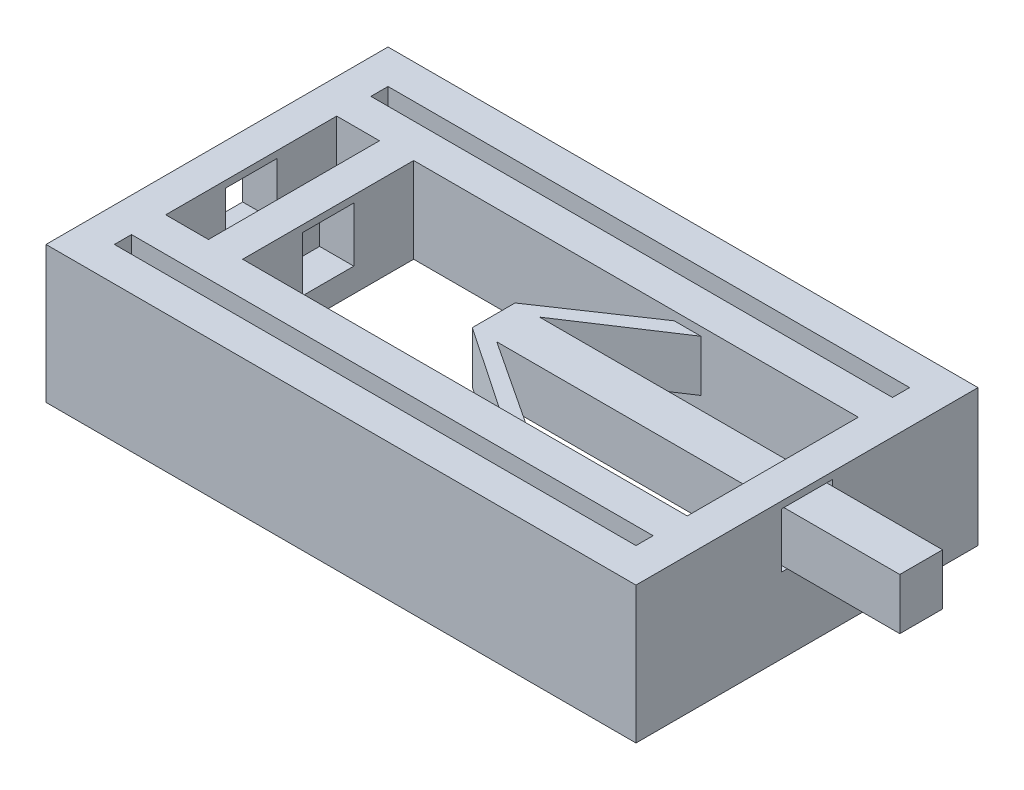
from build123d import *

# Parameters (mm, degrees)
BOSS_EXTRUDE2_DEPTH      = 3.5
BOSS_EXTRUDE2_DEPTH_BACK = 1.5
SKETCH2_W                = 34.5
SKETCH2_H                = 14
SKETCH2_W_2              = 2.5
SKETCH2_H_2              = 10
SKETCH2_W_3              = 26
BOSS_EXTRUDE5_DEPTH      = 3.5
BOSS_EXTRUDE5_DEPTH_BACK = 4.5
SKETCH9_W                = 30.5
SKETCH9_H                = 16
CUT_EXTRUDE1_DEPTH       = 2
CUT_EXTRUDE2_DEPTH       = 8
BOSS_EXTRUDE4_DEPTH      = 3
SKETCH5_W                = 7
SKETCH5_H                = 1
CUT_EXTRUDE3_DEPTH       = 1
CUT_EXTRUDE4_DEPTH       = 6
CUT_EXTRUDE4_DEPTH_BACK  = 6
SKETCH7_R                = 0.2


with BuildPart() as part:
    # Sketch2 → Boss-Extrude2 (new, two sides: drawn at the far end of the back side and taken through both)
    with BuildSketch(Plane(origin=(0, 0, 0), x_dir=(1, 0, 0), z_dir=(0, 1, 0)).offset(-BOSS_EXTRUDE2_DEPTH_BACK)):
        Rectangle(SKETCH2_W, SKETCH2_H)
        with Locations((-14, 0)):
            Rectangle(SKETCH2_W_2, SKETCH2_H_2, mode=Mode.SUBTRACT)
        with Locations((2.25, 0)):
            Rectangle(SKETCH2_W_3, SKETCH2_H_2, mode=Mode.SUBTRACT)
    extrude(amount=BOSS_EXTRUDE2_DEPTH + BOSS_EXTRUDE2_DEPTH_BACK)

    # Sketch9 → Boss-Extrude5 (add, two sides: drawn at the far end of the back side and taken through both)
    with BuildSketch(Plane(origin=(0, 0, 0), x_dir=(1, 0, 0), z_dir=(0, 1, 0)).offset(-BOSS_EXTRUDE5_DEPTH_BACK)):
        Polygon((17.25, -10), (17.25, 8), (17.25, 10), (15.25, 10), (-15.25, 10), (-17.25, 10), (-17.25, 8), (-17.25, -10), align=None)
        Rectangle(SKETCH9_W, SKETCH9_H, mode=Mode.SUBTRACT)
    extrude(amount=BOSS_EXTRUDE5_DEPTH + BOSS_EXTRUDE5_DEPTH_BACK)

    # Sketch3 → Cut-Extrude1 (cut)
    with BuildSketch(Plane(origin=(17.25, 0, 0), x_dir=(0, 0, -1), z_dir=(1, 0, 0))):
        Polygon((-1.5, 0), (-1.5, 3.1), (1.5, 3.1), (1.5, 0), (1.5, -0.1), (-1.5, -0.1), align=None)
    extrude(amount=-CUT_EXTRUDE1_DEPTH, mode=Mode.SUBTRACT)

    # Sketch4 → Cut-Extrude2 (cut)
    with BuildSketch(Plane.ZY.offset(17.25)):
        Polygon((-1.5, -0.1), (1.5, -0.1), (1.5, 0), (1.5, 3.1), (-1.5, 3.1), (-1.5, 0), align=None)
    extrude(amount=-CUT_EXTRUDE2_DEPTH, mode=Mode.SUBTRACT)

    # Sketch1 → Boss-Extrude4 (add)
    with BuildSketch(Plane(origin=(0, 0, 0), x_dir=(1, 0, 0), z_dir=(0, 1, 0))):
        Polygon((-1.07297499, -1.25), (4.486628642, -5), (4.486628642, -6), (6.049148178, -6), (6.049148178, -5), (0.35765833, -1.25), (1.07297499, -1.25), (23.92702501, -1.25), (23.92702501, 1.25), (1.07297499, 1.25), (0.35765833, 1.25), (6.049148178, 5), (6.049148178, 6), (4.486628642, 6), (4.486628642, 5), (-1.07297499, 1.25), align=None)
    extrude(amount=BOSS_EXTRUDE4_DEPTH)

    # Sketch5 → Cut-Extrude3 (cut)
    with BuildSketch(Plane.XZ):
        with Locations((3.5, 0)):
            Rectangle(SKETCH5_W, SKETCH5_H)
    extrude(amount=-CUT_EXTRUDE3_DEPTH, mode=Mode.SUBTRACT)

    # Sketch7 → Cut-Extrude4 (cut, two sides: drawn at the far end of the back side and taken through both)
    with BuildSketch(Plane.XY.offset(-CUT_EXTRUDE4_DEPTH_BACK)):
        with Locations((3.5, -1.2)):
            Circle(SKETCH7_R)
    extrude(amount=CUT_EXTRUDE4_DEPTH + CUT_EXTRUDE4_DEPTH_BACK, mode=Mode.SUBTRACT)


solid = part.part
